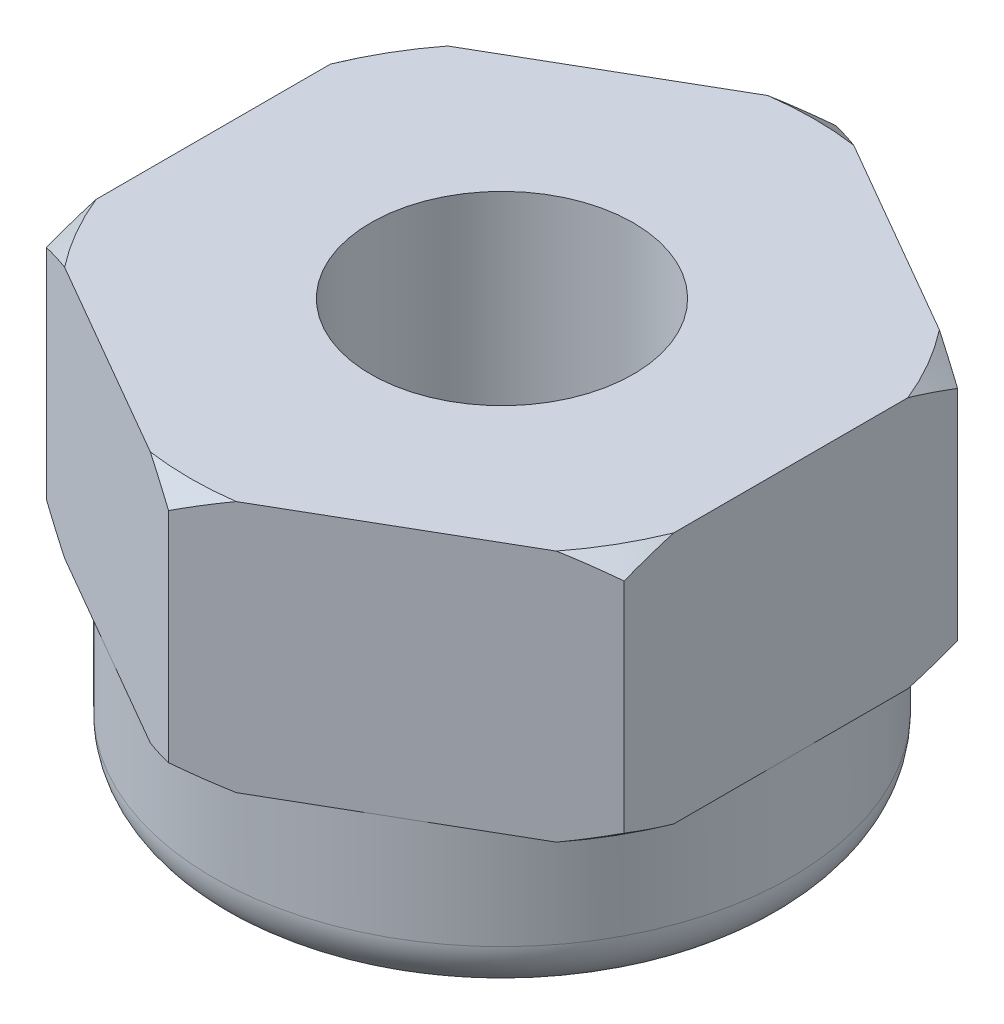
from build123d import *

# Parameters (mm, degrees)
EXTRUDE_1_DEPTH    = 2.4
SKETCH_2_R         = 2.75
EXTRUDE_2_DEPTH    = 1.5
FILLET_1_R         = 0.5
HOLE_WIZARD_M3_1_D = 2.5


with BuildPart() as part:
    # 草图1 → 凸台-拉伸1 (new body)
    with BuildSketch(Plane(origin=(0, 0, 0), x_dir=(1, 0, 0), z_dir=(0, 1, 0))):
        Polygon((0, 3.175426481), (-2.75, 1.58771324), (-2.75, -1.58771324), (0, -3.175426481), (2.75, -1.58771324), (2.75, 1.58771324), align=None)
    extrude(amount=EXTRUDE_1_DEPTH)

    # 草图2 → 凸台-拉伸2 (add)
    with BuildSketch(Plane.XZ):
        with Locations(Location((0, 0, 0), (0, 0, 120))):
            Circle(SKETCH_2_R)
    extrude(amount=EXTRUDE_2_DEPTH)

    # 圆角1
    fillet_1_edges = [part.edges().sort_by_distance(p)[0] for p in [
        (1.375, -1.5, -2.38156986),
    ]]
    fillet(fillet_1_edges, radius=FILLET_1_R)

    # M3 螺纹孔1 (through all)
    with Locations(Plane(origin=(0, -1.5, 0), x_dir=(-1, 0, 0), z_dir=(0, -1, 0))):
        with Locations((0, 0)):
            Hole(HOLE_WIZARD_M3_1_D / 2)

    # 草图7 → 切除-旋转2 (revolve, cut)
    with BuildSketch(Plane(origin=(0, 0, 0), x_dir=(0, 0, -1), z_dir=(1, 0, 0)), mode=Mode.PRIVATE) as cut_revolve_2_sk:
        Polygon((-3.271284624, 2.165513719), (-2.967407764, 2.4), (-3.334569784, 2.4), align=None)
        Polygon((-3.334569784, 0), (-3.271284624, 0.234486281), (-2.967407764, 0), align=None)
    revolve(cut_revolve_2_sk.sketch.rotate(Axis((0, 0, 0), (0, 1, 0)), 180), axis=Axis((0, 0, 0), (0, 1, 0)), mode=Mode.SUBTRACT)


solid = part.part
